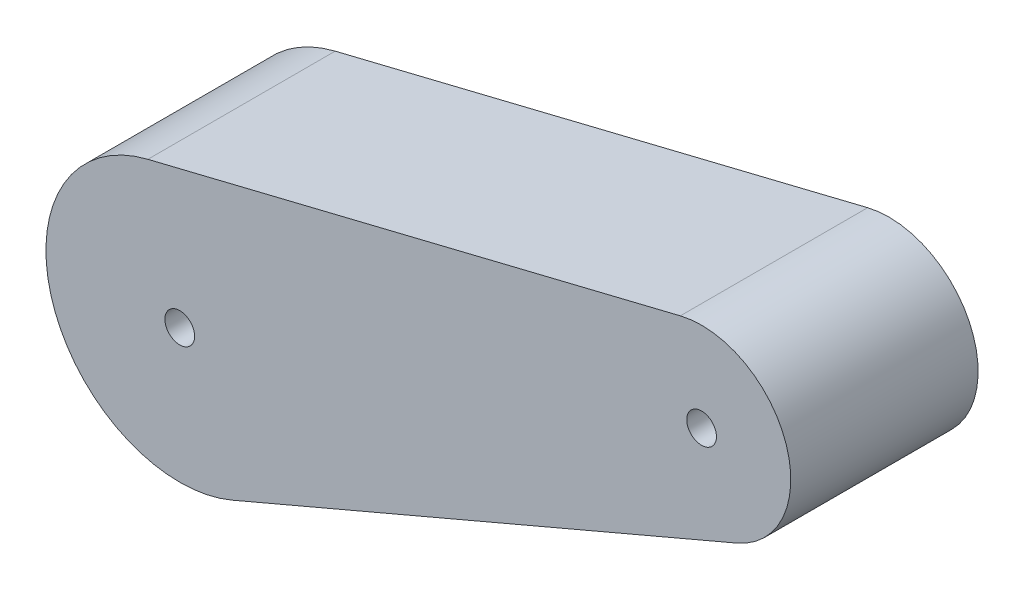
from build123d import *

# Parameters (mm, degrees)
SKETCH_1_R          = 5
BOSS_EXTRUDE1_DEPTH = 31.5


with BuildPart() as part:
    # 草圖1 → Boss-Extrude1 (new, symmetric)
    with BuildSketch(Plane.XY):
        with BuildLine():
            Line((-10.724057966, 43.703484766), (168.354262364, 87.646119959))
            ThreePointArc((168.354262364, 87.646119959), (203.963683154, 67.99864671), (187.26814937, 30.91343125))
            Line((187.26814937, 30.91343125), (17.646772542, -41.395548297))
            ThreePointArc((17.646772542, -41.395548297), (-42.690073218, -14.232274893), (-10.724057966, 43.703484766))
        make_face()
        with Locations((175.503634342, 58.510463448)):
            Circle(SKETCH_1_R, mode=Mode.SUBTRACT)
        Circle(SKETCH_1_R, mode=Mode.SUBTRACT)
    extrude(amount=BOSS_EXTRUDE1_DEPTH, both=True)


solid = part.part
